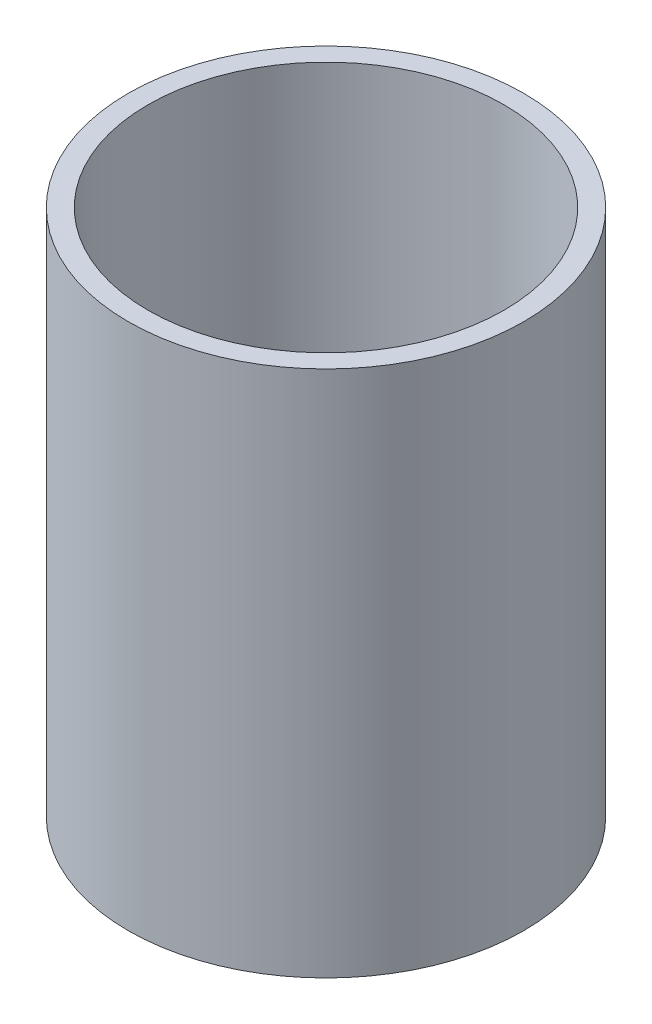
from build123d import *

# Parameters (mm, degrees)
SKETCH_1_R      = 30
SKETCH_1_R_2    = 27
EXTRUDE_1_DEPTH = 80


with BuildPart() as part:
    # 스케치1 → 보스-돌출1 (new body)
    with BuildSketch(Plane(origin=(0, 0, 0), x_dir=(1, 0, 0), z_dir=(0, 1, 0))):
        with Locations(Location((0, 0, 0), (0, 0, 270))):
            Circle(SKETCH_1_R)
        with Locations(Location((0, 0, 0), (0, 0, 270))):
            Circle(SKETCH_1_R_2, mode=Mode.SUBTRACT)
    extrude(amount=EXTRUDE_1_DEPTH)


solid = part.part
